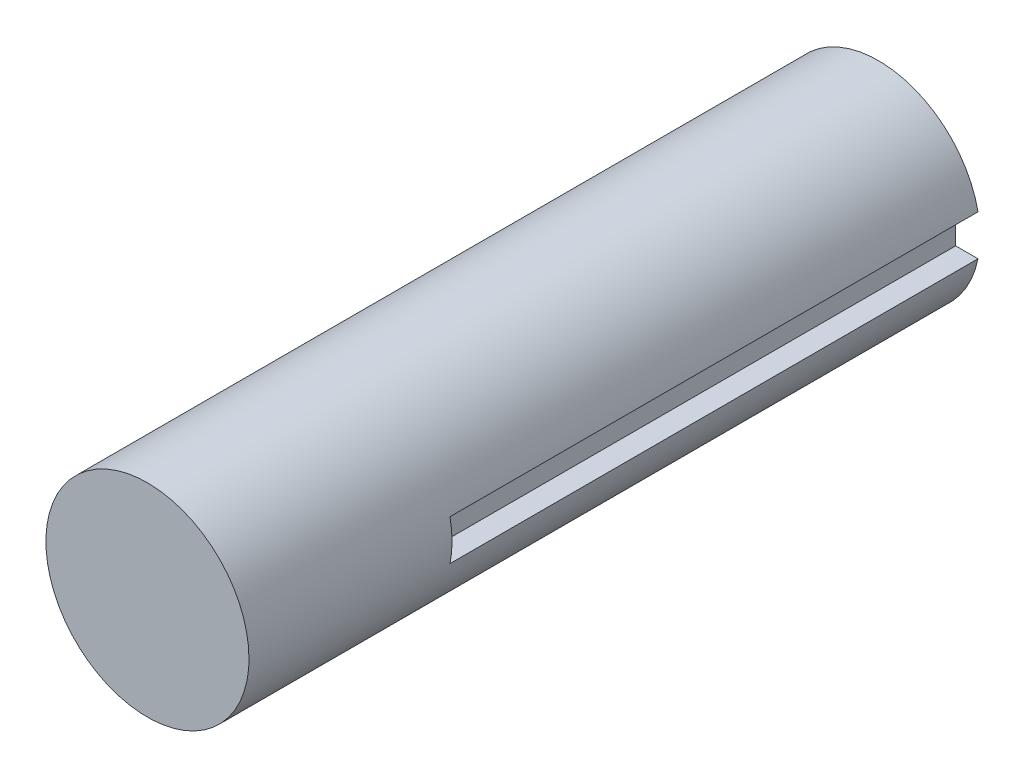
from build123d import *

# Parameters (mm, degrees)
SKETCH2_R           = 50
BOSS_EXTRUDE1_DEPTH = 360
CUT_EXTRUDE2_DEPTH  = 260


with BuildPart() as part:
    # Sketch2 → Boss-Extrude1 (new body)
    with BuildSketch(Plane.XY):
        with Locations(Location((0, 0, 0), (0, 0, 180))):
            Circle(SKETCH2_R)
    extrude(amount=BOSS_EXTRUDE1_DEPTH)

    # Sketch3 → Cut-Extrude2 (cut)
    with BuildSketch(Plane.XY):
        with BuildLine():
            Line((48.989794856, 10), (37.979794856, 10))
            Line((37.979794856, 10), (37.979794856, -10))
            Line((37.979794856, -10), (48.989794856, -10))
            ThreePointArc((48.989794856, -10), (50, 0), (48.989794856, 10))
        make_face()
    extrude(amount=CUT_EXTRUDE2_DEPTH, mode=Mode.SUBTRACT)


solid = part.part
